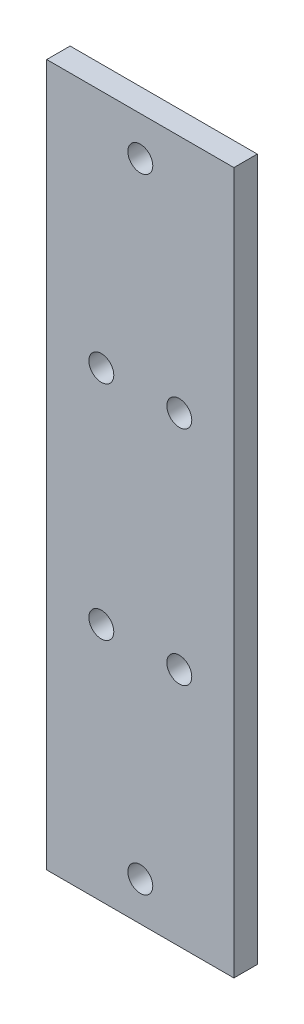
from build123d import *

# Parameters (mm, degrees)
SKETCH1_W           = 24
SKETCH1_H           = 90
SKETCH1_R           = 1.6
BOSS_EXTRUDE1_DEPTH = 3


with BuildPart() as part:
    # Sketch1 → Boss-Extrude1 (new body)
    with BuildSketch(Plane.XY):
        with Locations((12, 45)):
            Rectangle(SKETCH1_W, SKETCH1_H)
        with Locations((7, 59.25)):
            Circle(SKETCH1_R, mode=Mode.SUBTRACT)
        with Locations((17, 59.25)):
            Circle(SKETCH1_R, mode=Mode.SUBTRACT)
        with Locations((7, 30.75)):
            Circle(SKETCH1_R, mode=Mode.SUBTRACT)
        with Locations((17, 30.75)):
            Circle(SKETCH1_R, mode=Mode.SUBTRACT)
        with Locations((12, 85)):
            Circle(SKETCH1_R, mode=Mode.SUBTRACT)
        with Locations((12, 5)):
            Circle(SKETCH1_R, mode=Mode.SUBTRACT)
    extrude(amount=BOSS_EXTRUDE1_DEPTH)


solid = part.part
